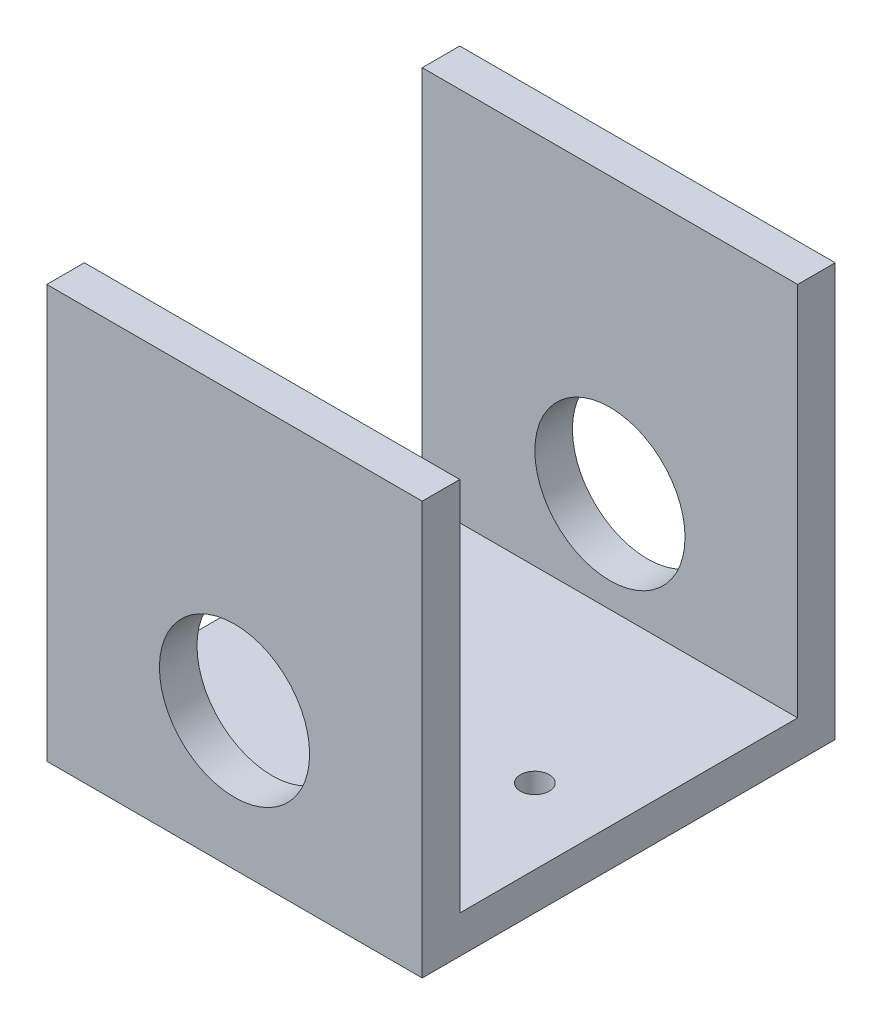
from build123d import *

# Parameters (mm, degrees)
SKETCH1_W           = 30
SKETCH1_H           = 30
SKETCH1_R           = 1.15
BOSS_EXTRUDE1_DEPTH = 3
SKETCH2_W           = 30
SKETCH2_H           = 3
BOSS_EXTRUDE2_DEPTH = 30
CUT_EXTRUDE1_REACH  = 55.749
SKETCH3_R           = 6
SKETCH4_W           = 30
SKETCH4_H           = 33
SKETCH4_R           = 6
BOSS_EXTRUDE3_DEPTH = 3


with BuildPart() as part:
    # Sketch1 → Boss-Extrude1 (new body)
    with BuildSketch(Plane(origin=(0, 0, 0), x_dir=(1, 0, 0), z_dir=(0, 1, 0))):
        with Locations((15, 15)):
            Rectangle(SKETCH1_W, SKETCH1_H)
        with Locations(Location((5.999988, 12, 0), (0, 0, 270))):
            Circle(SKETCH1_R, mode=Mode.SUBTRACT)
        with Locations(Location((23.999988, 12, 0), (0, 0, 270))):
            Circle(SKETCH1_R, mode=Mode.SUBTRACT)
    extrude(amount=BOSS_EXTRUDE1_DEPTH)

    # Sketch2 → Boss-Extrude2 (add)
    with BuildSketch(Plane(origin=(0, 3, 0), x_dir=(1, 0, 0), z_dir=(0, 1, 0))):
        with Locations((15, 28.5)):
            Rectangle(SKETCH2_W, SKETCH2_H)
    extrude(amount=BOSS_EXTRUDE2_DEPTH)

    # Sketch3 → Cut-Extrude1 (cut, up to next)
    with BuildSketch(Plane(origin=(0, 0, -30), x_dir=(-1, 0, 0), z_dir=(0, 0, -1)), mode=Mode.PRIVATE) as cut_extrude1_sk1:
        with Locations((-15, 11)):
            Circle(SKETCH3_R)
    cut_extrude1_tool1 = extrude(cut_extrude1_sk1.sketch, amount=-CUT_EXTRUDE1_REACH, mode=Mode.PRIVATE) & part.part
    add(cut_extrude1_tool1.solids().sort_by_distance((15, 11, -30))[0], mode=Mode.SUBTRACT)

    # Sketch4 → Boss-Extrude3 (add)
    with BuildSketch(Plane.XY):
        with Locations((15, 16.5)):
            Rectangle(SKETCH4_W, SKETCH4_H)
        with Locations(Location((15, 11, 0), (0, 0, 180))):
            Circle(SKETCH4_R, mode=Mode.SUBTRACT)
    extrude(amount=BOSS_EXTRUDE3_DEPTH)


solid = part.part
